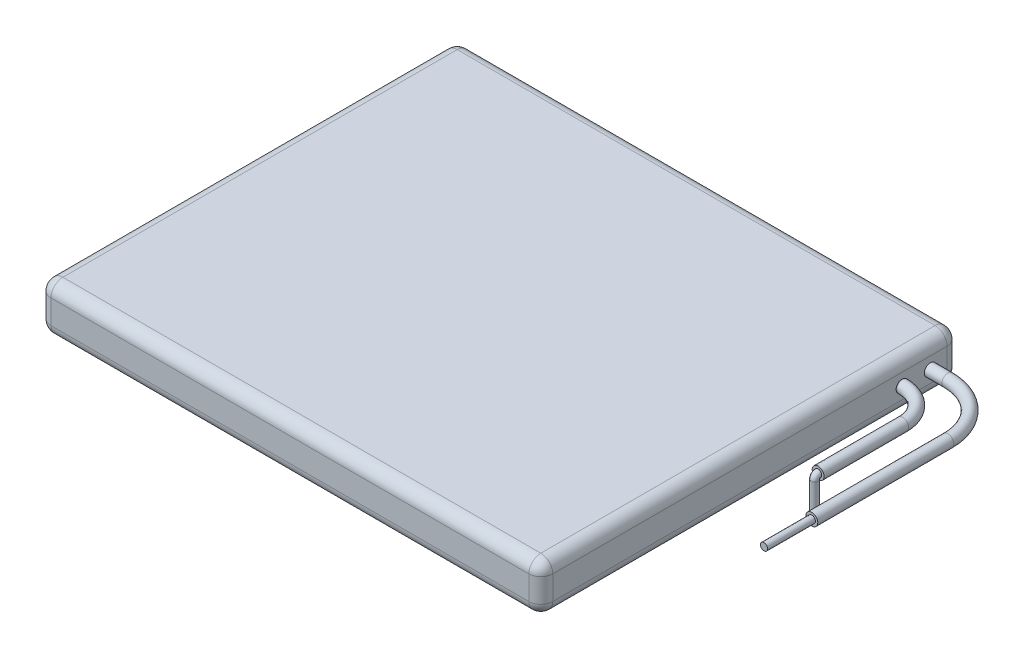
from build123d import *

# Parameters (mm, degrees)
SKETCH1_W           = 42
SKETCH1_H           = 35
BOSS_EXTRUDE1_DEPTH = 4
FILLET1_R           = 1
FILLET2_R           = 1
SKETCH2_R           = 0.5
SKETCH5_R           = 0.5
SKETCH10_R          = 0.3
SKETCH13_R          = 0.3
BOSS_EXTRUDE2_DEPTH = 4


with BuildPart() as part:
    # Sketch1 → Boss-Extrude1 (new body)
    with BuildSketch(Plane(origin=(0, 0, 0), x_dir=(1, 0, 0), z_dir=(0, 1, 0))):
        with Locations((21, 17.5)):
            Rectangle(SKETCH1_W, SKETCH1_H)
    extrude(amount=BOSS_EXTRUDE1_DEPTH)

    # Fillet1
    fillet1_edges = [part.edges().sort_by_distance(p)[0] for p in [
        (0, 2, 0),
        (42, 2, 0),
        (42, 2, -35),
        (0, 2, -35),
    ]]
    fillet(fillet1_edges, radius=FILLET1_R)

    # Fillet2
    fillet2_edges = [part.edges().sort_by_distance(p)[0] for p in [
        (42, 0, -17.5),
        (42, 4, -17.5),
        (0, 0, -17.5),
        (21, 0, -35),
        (21, 0, 0),
        (0.292893219, 0, -0.292893219),
        (0.292893219, 0, -34.707106781),
        (41.707106781, 0, -34.707106781),
        (41.707106781, 0, -0.292893219),
        (21, 4, 0),
        (0, 4, -17.5),
        (21, 4, -35),
        (0.292893219, 4, -0.292893219),
        (0.292893219, 4, -34.707106781),
        (41.707106781, 4, -34.707106781),
        (41.707106781, 4, -0.292893219),
    ]]
    fillet(fillet2_edges, radius=FILLET2_R)

    # Sweep2: sweep along a path in Sketch4
    with BuildLine(Plane(origin=(0, 0, 0), x_dir=(1, 0, 0), z_dir=(0, 1, 0))) as sweep2_path:
        Line((42, 32.598834146), (43.472011027, 32.598834146))
        ThreePointArc((43.472011027, 32.598834146), (46.584840442, 31.309457985), (47.874216603, 28.19662857))
        Line((47.874216603, 28.19662857), (47.874216603, 16.805737351))
    # Sketch2 → Sweep2 (sweep)
    with BuildSketch(Plane(origin=(42, 0, 0), x_dir=(0, 0, -1), z_dir=(1, 0, 0))):
        with Locations((32.598834146, 2)):
            Circle(SKETCH2_R)
    sweep(path=sweep2_path.line)

    # Sweep3: sweep along a path in Sketch6
    with BuildLine(Plane(origin=(0, 0, 0), x_dir=(1, 0, 0), z_dir=(0, 1, 0))) as sweep3_path:
        Line((42, 30.237830041), (42.053967758, 30.237830041))
        ThreePointArc((42.053967758, 30.237830041), (43.992158066, 29.435005329), (44.794982779, 27.49681502))
        Line((44.794982779, 27.49681502), (44.794982779, 20.415467716))
    # Sketch5 → Sweep3 (sweep)
    with BuildSketch(Plane(origin=(42, 0, 0), x_dir=(0, 0, -1), z_dir=(1, 0, 0))):
        with Locations((30.237830041, 2)):
            Circle(SKETCH5_R)
    sweep(path=sweep3_path.line)

    # Sweep5: sweep along a path in Sketch12
    with BuildLine(Plane(origin=(44.828772476, 0, 0), x_dir=(0, 0, -1), z_dir=(1, 0, 0))) as sweep5_path:
        Line((20.415467716, 2), (20.413075866, 2))
        ThreePointArc((20.413075866, 2), (20.200943832, 1.912132034), (20.113075866, 1.7))
        Line((20.113075866, 1.7), (20.113075866, -1.34465824))
    # Sketch10 → Sweep5 (sweep)
    with BuildSketch(Plane.XY.offset(-20.415467716)):
        with Locations((44.794982779, 2)):
            Circle(SKETCH10_R)
    sweep(path=sweep5_path.line)

    # Sketch13 → Boss-Extrude2 (add)
    with BuildSketch(Plane.XY.offset(-16.805737351)):
        with Locations((47.874216603, 2)):
            Circle(SKETCH13_R)
    extrude(amount=BOSS_EXTRUDE2_DEPTH)


solid = part.part
